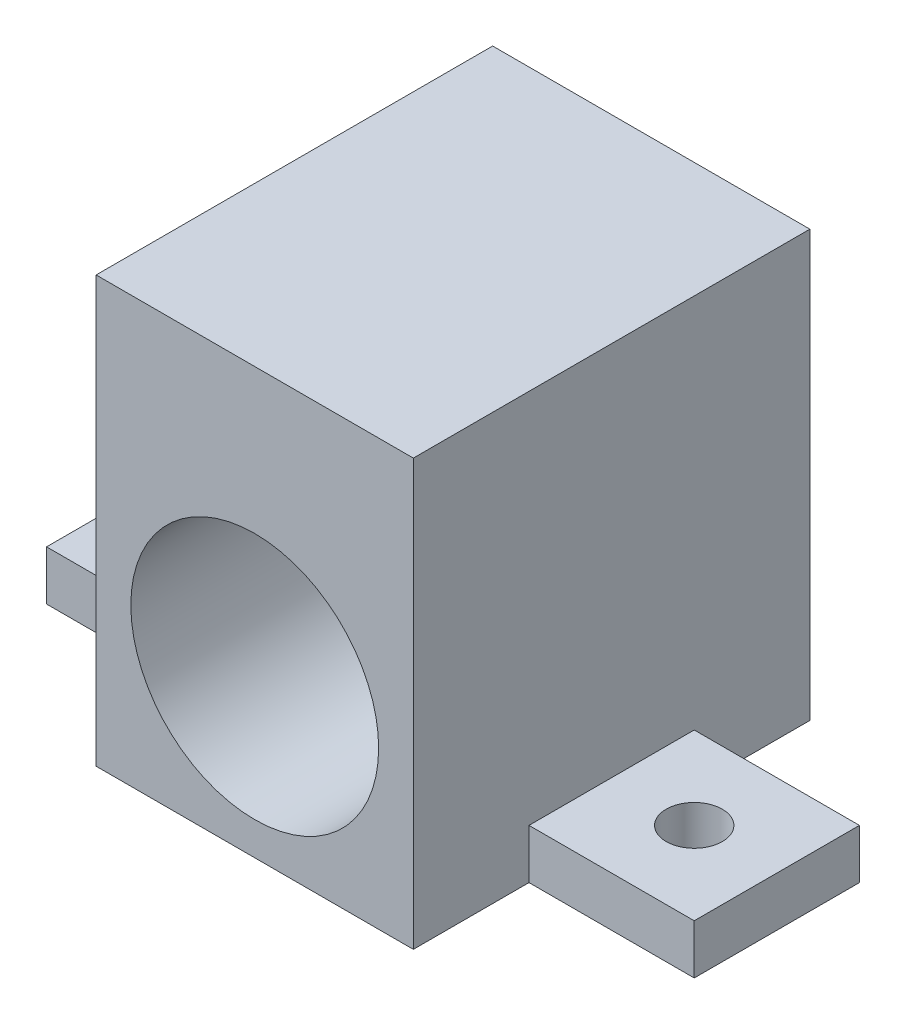
from build123d import *

# Parameters (mm, degrees)
SKETCH1_R           = 1.7
BOSS_EXTRUDE1_DEPTH = 3
SKETCH2_W           = 19.2
SKETCH2_H           = 24
BOSS_EXTRUDE2_DEPTH = 22.752
SKETCH3_R           = 7.5
CUT_EXTRUDE1_DEPTH  = 41.290513821


with BuildPart() as part:
    # Sketch1 → Boss-Extrude1 (new body)
    with BuildSketch(Plane(origin=(0, 0, 0), x_dir=(1, 0, 0), z_dir=(0, 1, 0))):
        Polygon((-9.6, 5), (-9.6, 12), (9.6, 12), (9.6, 5), (19.6, 5), (19.6, -5), (9.6, -5), (9.6, -12), (-9.6, -12), (-9.6, -5), (-19.6, -5), (-19.6, 5), align=None)
        with Locations(Location((-14.6, 0, 0), (0, 0, 270))):
            Circle(SKETCH1_R, mode=Mode.SUBTRACT)
        with Locations(Location((14.6, 0, 0), (0, 0, 270))):
            Circle(SKETCH1_R, mode=Mode.SUBTRACT)
    extrude(amount=BOSS_EXTRUDE1_DEPTH)

    # Sketch2 → Boss-Extrude2 (add)
    with BuildSketch(Plane(origin=(0, 3, 0), x_dir=(1, 0, 0), z_dir=(0, 1, 0))):
        Rectangle(SKETCH2_W, SKETCH2_H)
    extrude(amount=BOSS_EXTRUDE2_DEPTH)

    # Sketch3 → Cut-Extrude1 (cut, through all)
    with BuildSketch(Plane.XY.offset(12)):
        with Locations((0, 9.5)):
            Circle(SKETCH3_R)
    extrude(amount=-CUT_EXTRUDE1_DEPTH, mode=Mode.SUBTRACT)


solid = part.part
